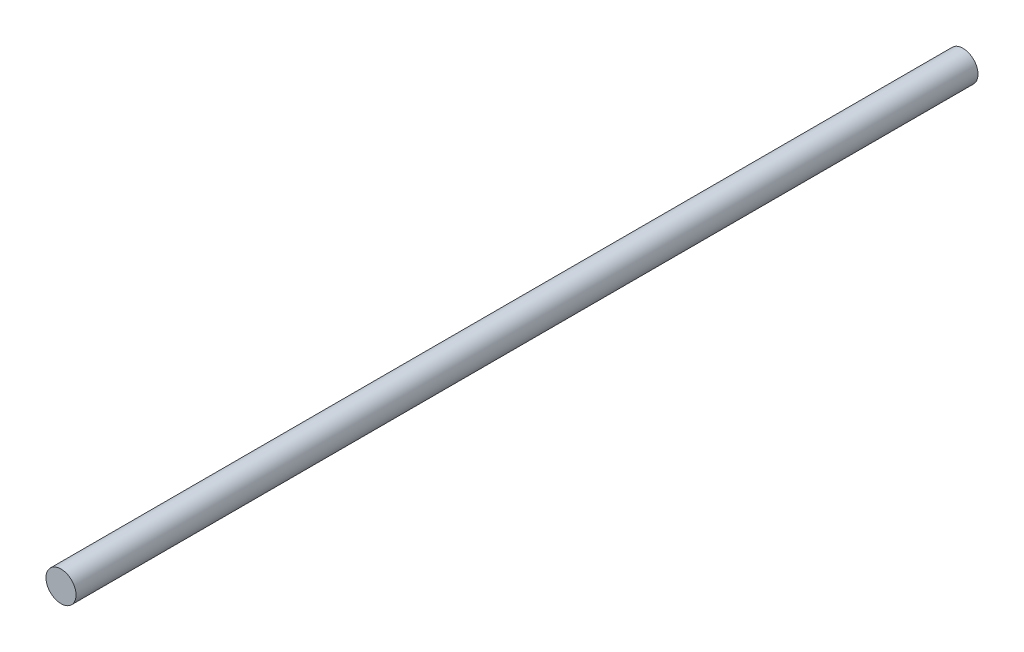
from build123d import *

# Parameters (mm, degrees)
SKETCH_1_R      = 4
EXTRUDE_1_DEPTH = 120


with BuildPart() as part:
    # Эскиз1 → Бобышка-Вытянуть1 (new, symmetric)
    with BuildSketch(Plane.XY):
        Circle(SKETCH_1_R)
    extrude(amount=EXTRUDE_1_DEPTH, both=True)


solid = part.part
